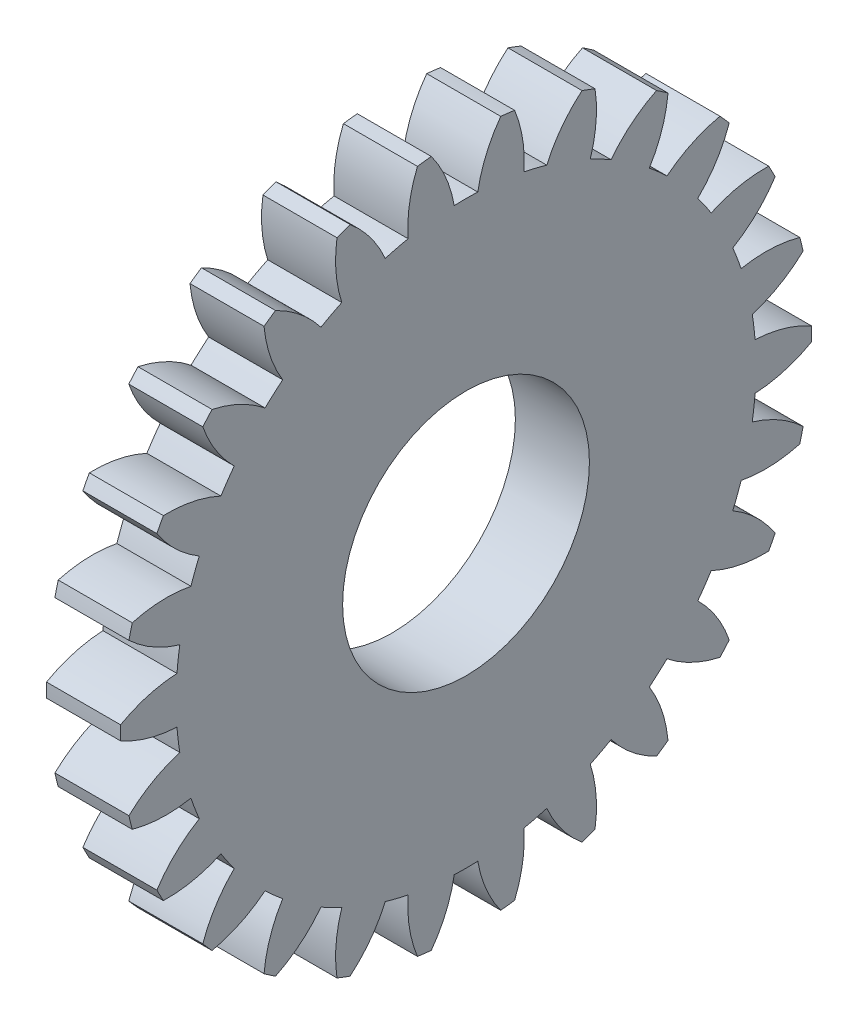
from build123d import *

# Parameters (mm, degrees)
BASPROSKE_W         = 3
BASPROSKE_H         = 14
TOOTHCUT_DEPTH      = 21.024984395
TEETHCUTS_COUNT     = 26
TEETHCUTS_ANGLE     = 346.153846154
BORSKE_R            = 4
BORE_DEPTH          = 50.0000508
EXTRUDE_START       = -3
SKETCH_1_R          = 4
EXTRUDE_1_DEPTH     = 3
SKETCH_2_R          = 5
CUT_EXTRUDE_1_DEPTH = 3


with BuildPart() as part:
    # BasProSke → Base-Revolve (revolve)
    with BuildSketch(Plane(origin=(0, 0, 0), x_dir=(1, 0, 0), z_dir=(0, 1, 0)), mode=Mode.PRIVATE) as base_revolve_sk:
        with Locations((1.5, 7)):
            Rectangle(BASPROSKE_W, BASPROSKE_H)
    revolve(base_revolve_sk.sketch.rotate(Axis((-10, 0, 0), (1, 0, 0)), 180), axis=Axis((-10, 0, 0), (1, 0, 0)))

    # TooCutSke → ToothCut (cut, through all)
    with BuildSketch(Plane(origin=(0, 0, 0), x_dir=(0, 0, -1), z_dir=(1, 0, 0))):
        with BuildLine():
            ThreePointArc((0.476965065, 11.739314517), (0, 11.749), (-0.476965065, 11.739314517))
            ThreePointArc((-0.476965065, 11.739314517), (-0.82065865, 12.901686978), (-1.424117301, 13.952911348))
            ThreePointArc((-1.424117301, 13.952911348), (0, 14.0254), (1.424117301, 13.952911348))
            ThreePointArc((1.424117301, 13.952911348), (0.82065865, 12.901686978), (0.476965065, 11.739314517))
        make_face()
    toothcut = extrude(amount=TOOTHCUT_DEPTH, mode=Mode.SUBTRACT)

    # TeethCuts: ToothCut ×26 about axis
    teethcuts_axis = Axis((-10, 0, 0), (1, 0, 0))
    for i in range(1, TEETHCUTS_COUNT):
        add(toothcut.rotate(teethcuts_axis, i * TEETHCUTS_ANGLE / (TEETHCUTS_COUNT - 1)), mode=Mode.SUBTRACT)

    # BorSke → Bore (cut, symmetric)
    with BuildSketch(Plane(origin=(0, 0, 0), x_dir=(0, 0, -1), z_dir=(1, 0, 0))):
        with Locations(Location((0, 0, 0), (0, 0, 180))):
            Circle(BORSKE_R)
    extrude(amount=BORE_DEPTH, both=True, mode=Mode.SUBTRACT)

    # ｽｹｯﾁ1 → ﾎﾞｽ - 押し出し1 (add)
    with BuildSketch(Plane.ZY.offset(EXTRUDE_START)):
        Circle(SKETCH_1_R)
    extrude(amount=EXTRUDE_1_DEPTH)

    # ｽｹｯﾁ2 → ｶｯﾄ - 押し出し1 (cut)
    with BuildSketch(Plane.ZY):
        Circle(SKETCH_2_R)
    extrude(amount=-CUT_EXTRUDE_1_DEPTH, mode=Mode.SUBTRACT)


solid = part.part
